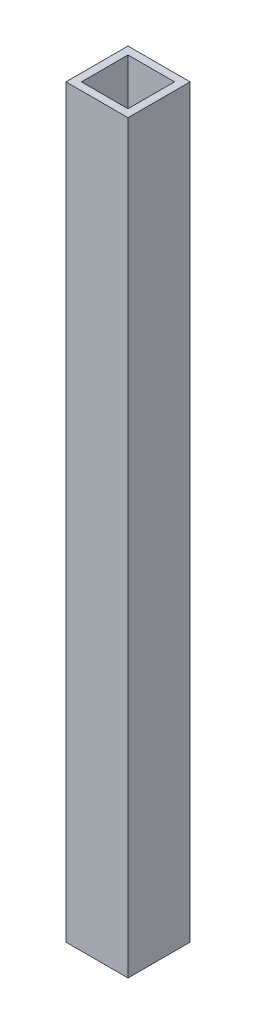
from build123d import *

# Parameters (mm, degrees)
SKETCH1_W           = 25.4
SKETCH1_H           = 25.4
BOSS_EXTRUDE1_DEPTH = 304.8
SHELL1_T            = -3.175


with BuildPart() as part:
    # Sketch1 → Boss-Extrude1 (new body)
    with BuildSketch(Plane(origin=(0, 0, 0), x_dir=(1, 0, 0), z_dir=(0, 1, 0))):
        Rectangle(SKETCH1_W, SKETCH1_H)
    extrude(amount=BOSS_EXTRUDE1_DEPTH)

    # Shell1
    shell1_openings = [part.faces().sort_by_distance(p)[0] for p in [
        (0, 304.8, 0),
        (0, 0, 0),
    ]]
    offset(amount=SHELL1_T, openings=shell1_openings, kind=Kind.INTERSECTION)


solid = part.part
